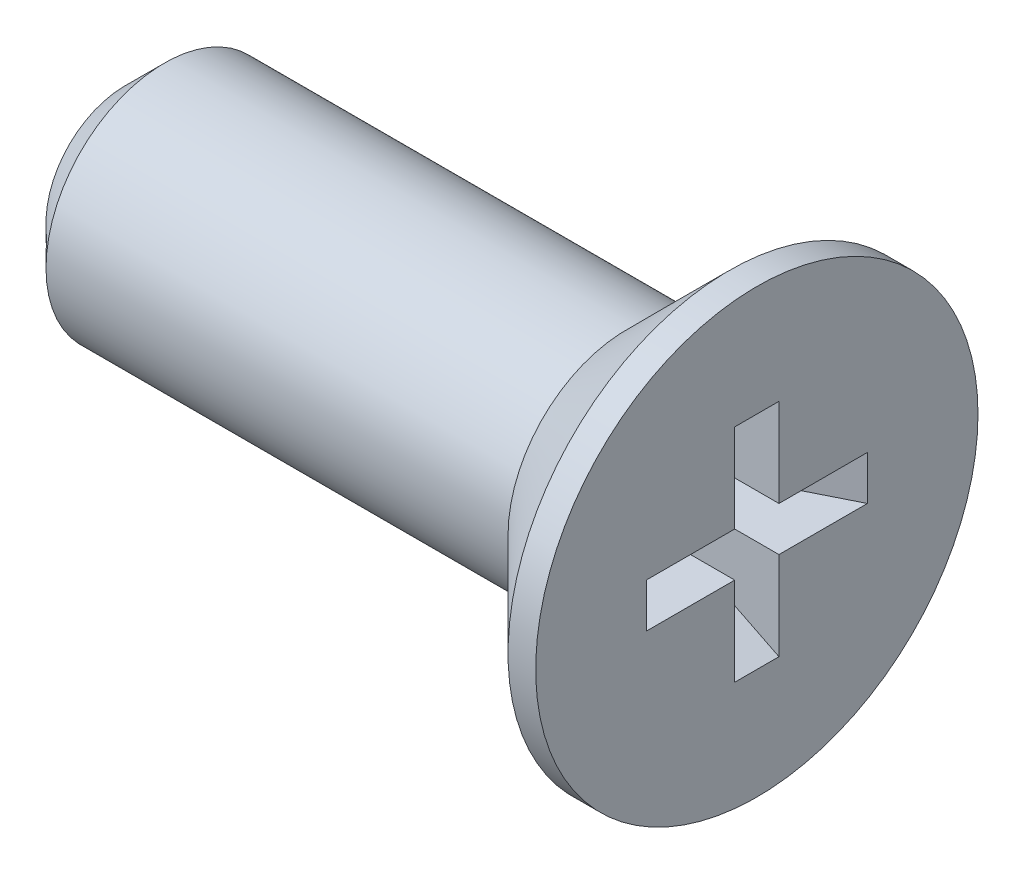
from build123d import *

# Parameters (mm, degrees)
SKETCH_1_R               = 1.5
EXTRUDE_606_DEPTH        = 8
CHAMFER_689_SIZE         = 0.5
CUT_EXTRUDE_1_DEPTH      = 0.28
PATTERN_CIRCULAR_1_COUNT = 2
PATTERN_CIRCULAR_1_ANGLE = 90


with BuildPart() as part:
    # Эскиз1 → Extrude 606 (new body)
    with BuildSketch(Plane(origin=(0, 0, 0), x_dir=(0, 0, -1), z_dir=(1, 0, 0))):
        Circle(SKETCH_1_R)
    extrude(amount=-EXTRUDE_606_DEPTH)

    # Chamfer 689
    chamfer_689_edges = [part.edges().sort_by_distance(p)[0] for p in [
        (-8, 0, 1.5),
    ]]
    chamfer(chamfer_689_edges, length=CHAMFER_689_SIZE)

    # Эскиз7 → Revolve 901 (revolve)
    with BuildSketch(Plane.XY, mode=Mode.PRIVATE) as revolve_901_sk:
        Polygon((0, 0), (0, 2.8), (-0.35, 2.8), (-1.65, 1.5), (-1.65, 0), align=None)
    revolve(revolve_901_sk.sketch.rotate(Axis((0, 0, 0), (-1, 0, 0)), 90), axis=Axis((0, 0, 0), (-1, 0, 0)))

    # Эскиз10 → Вырез-Вытянуть1 (cut, symmetric)
    with BuildSketch(Plane.XY):
        Polygon((0, 1.4), (0, -1.4), (-1.5, -0.652127588), (-1.697863748, -0.28), (-1.697863748, 0.28), (-1.5, 0.652127588), align=None)
    cut_extrude_1 = extrude(amount=CUT_EXTRUDE_1_DEPTH, both=True, mode=Mode.SUBTRACT)

    # Круговой массив1: Вырез-Вытянуть1 ×2 about axis
    pattern_circular_1_axis = Axis((0, 0, 0), (1, 0, 0))
    for i in range(1, PATTERN_CIRCULAR_1_COUNT):
        add(cut_extrude_1.rotate(pattern_circular_1_axis, i * PATTERN_CIRCULAR_1_ANGLE / (PATTERN_CIRCULAR_1_COUNT - 1)), mode=Mode.SUBTRACT)


solid = part.part
